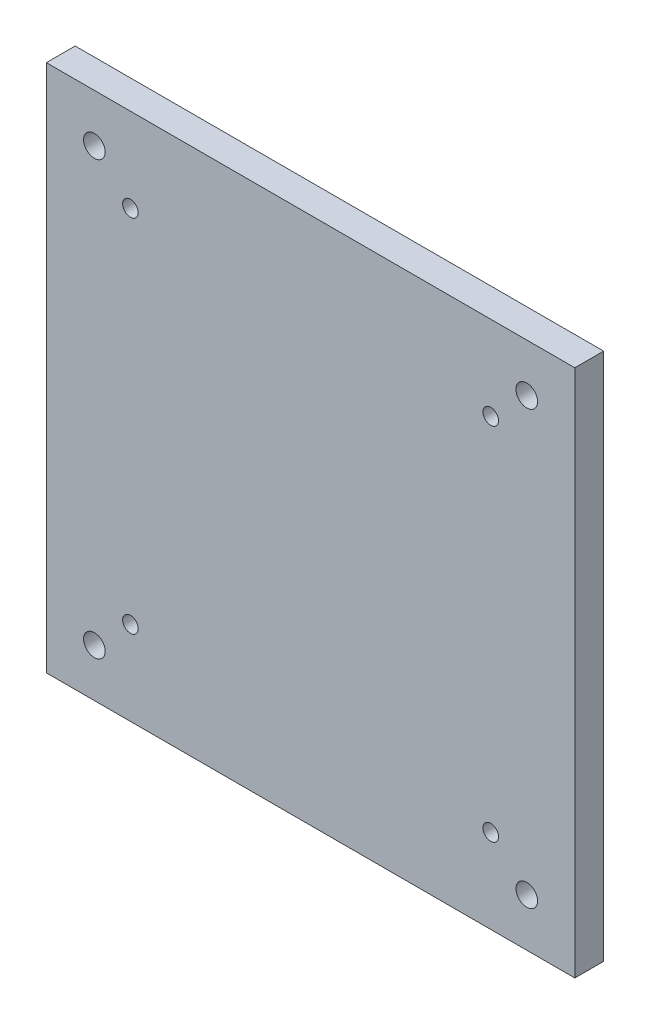
from build123d import *

# Parameters (mm, degrees)
SKETCH_1_W          = 220
SKETCH_1_H          = 220
EXTRUDE_1_DEPTH     = 12
SKETCH_2_R          = 4.5
SKETCH_2_R_2        = 3.25
CUT_EXTRUDE_1_DEPTH = 13
SKETCH_3_R          = 5.5
CUT_EXTRUDE_2_DEPTH = 6.5


with BuildPart() as part:
    # 草图1 → 凸台-拉伸1 (new body)
    with BuildSketch(Plane.XY):
        Rectangle(SKETCH_1_W, SKETCH_1_H)
    extrude(amount=EXTRUDE_1_DEPTH)

    # 草图2 → 切除-拉伸1 (cut)
    with BuildSketch(Plane(origin=(0, 0, 0), x_dir=(-1, 0, 0), z_dir=(0, 0, -1))):
        with Locations((90, -90)):
            Circle(SKETCH_2_R)
        with Locations((90, 90)):
            Circle(SKETCH_2_R)
        with Locations((-90, -90)):
            Circle(SKETCH_2_R)
        with Locations((-90, 90)):
            Circle(SKETCH_2_R)
        with Locations((75, -75)):
            Circle(SKETCH_2_R_2)
        with Locations((75, 75)):
            Circle(SKETCH_2_R_2)
        with Locations((-75, -75)):
            Circle(SKETCH_2_R_2)
        with Locations((-75, 75)):
            Circle(SKETCH_2_R_2)
    extrude(amount=-CUT_EXTRUDE_1_DEPTH, mode=Mode.SUBTRACT)

    # 草图3 → 切除-拉伸2 (cut)
    with BuildSketch(Plane(origin=(0, 0, 0), x_dir=(-1, 0, 0), z_dir=(0, 0, -1))):
        with Locations((75, -75)):
            Circle(SKETCH_3_R)
        with Locations((75, 75)):
            Circle(SKETCH_3_R)
        with Locations((-75, -75)):
            Circle(SKETCH_3_R)
        with Locations((-75, 75)):
            Circle(SKETCH_3_R)
    extrude(amount=-CUT_EXTRUDE_2_DEPTH, mode=Mode.SUBTRACT)


solid = part.part
